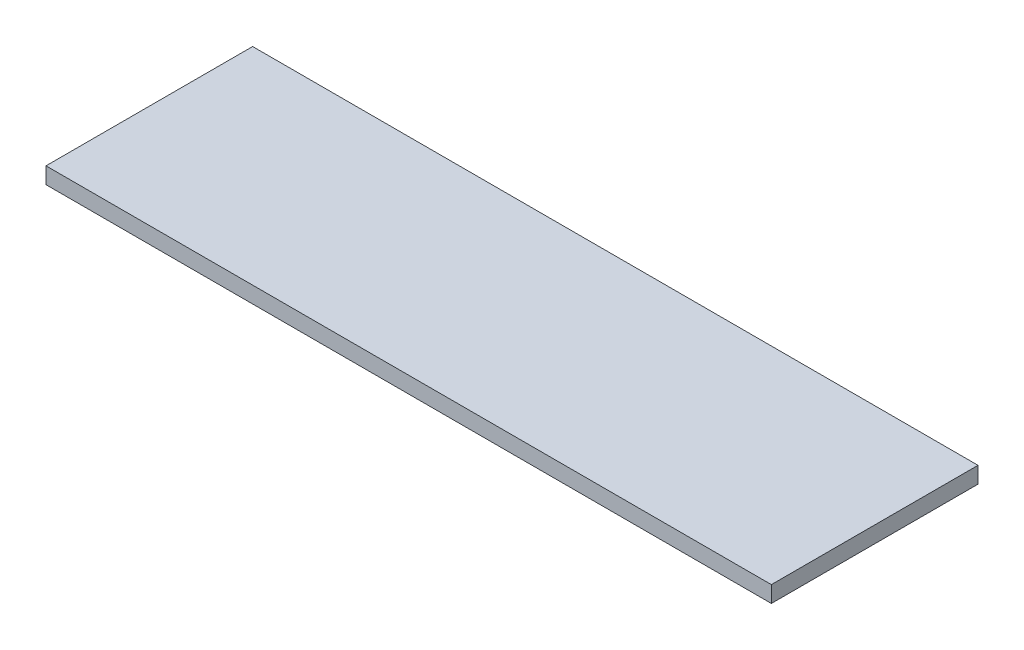
from build123d import *

# Parameters (mm, degrees)
BOSS_EXTRUDE1_DEPTH      = 209.4
BOSS_EXTRUDE1_DEPTH_BACK = 18
SKETCH1_W                = 798.236516538
SKETCH1_H                = 18


with BuildPart() as part:
    # Sketch1 → Boss-Extrude1 (new, two sides: drawn at the far end of the back side and taken through both)
    with BuildSketch(Plane.XY.offset(-BOSS_EXTRUDE1_DEPTH_BACK)):
        with Locations((-414.118258269, -9)):
            Rectangle(SKETCH1_W, SKETCH1_H)
    extrude(amount=BOSS_EXTRUDE1_DEPTH + BOSS_EXTRUDE1_DEPTH_BACK)


solid = part.part
